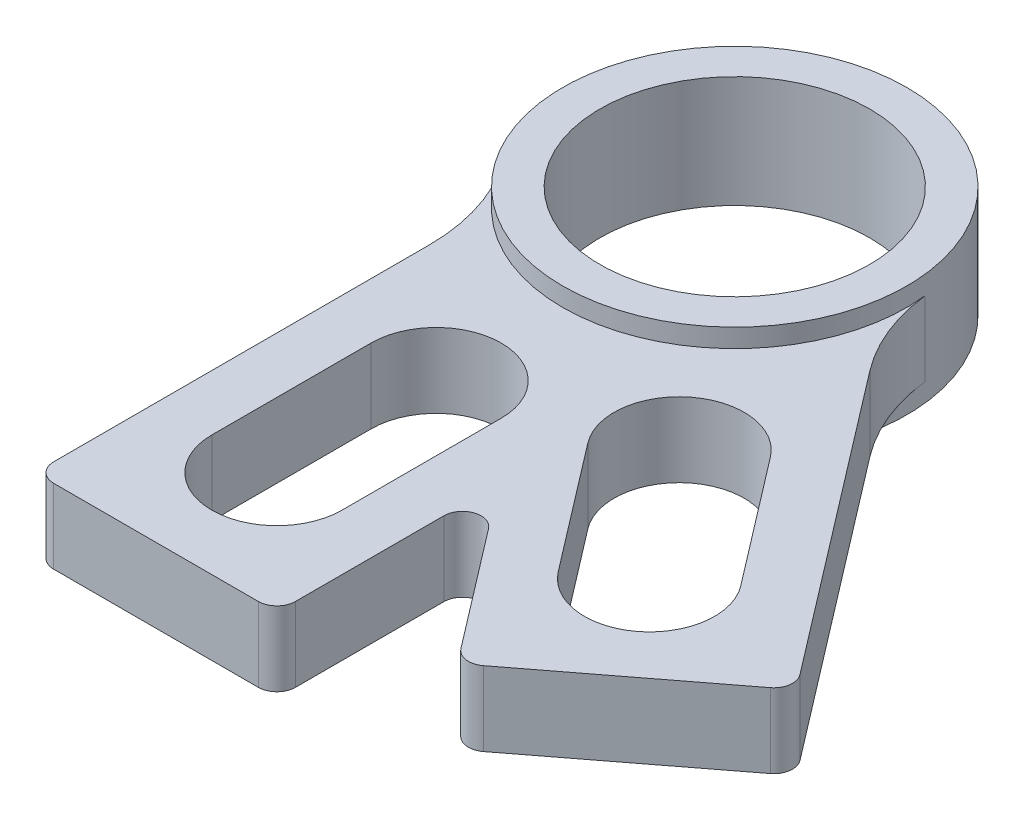
from build123d import *

# Parameters (mm, degrees)
SKETCH1_R                      = 14.6812
SKETCH1_R_2                    = 11.5062
BEARING_INSERT_EXTRUDE_DEPTH   = 4.7625
APEX_SLOT_INSERT_EXTRUDE_DEPTH = 3.175
FILLET1_R                      = 16.002
FILLET2_R                      = 1.5875


with BuildPart() as part:
    # Sketch1 → Bearing_Insert_Extrude (new, symmetric)
    with BuildSketch(Plane(origin=(0, 0, 0), x_dir=(1, 0, 0), z_dir=(0, 1, 0))):
        with Locations(Location((0, 0, 0), (0, 0, 90))):
            Circle(SKETCH1_R)
        with Locations(Location((0, 0, 0), (0, 0, 90))):
            Circle(SKETCH1_R_2, mode=Mode.SUBTRACT)
    extrude(amount=BEARING_INSERT_EXTRUDE_DEPTH, both=True)

    # Sketch1<4> → Apex_Slot_Insert_Extrude (add, symmetric)
    with BuildSketch(Plane(origin=(0, 0, 0), x_dir=(1, 0, 0), z_dir=(0, 1, 0))):
        with BuildLine():
            Line((-10.31875, -10.443228997), (-10.31875, -49.3903))
            Line((-10.31875, -49.3903), (10.31875, -49.3903))
            Line((10.31875, -49.3903), (10.31875, -30.456674331))
            Line((10.31875, -30.456674331), (21.827200563, -45.491226091))
            Line((21.827200563, -45.491226091), (38.2147413, -32.947107355))
            Line((38.2147413, -32.947107355), (14.541491968, -2.020555561))
            ThreePointArc((14.541491968, -2.020555561), (4.710970641, -13.904833298), (-10.31875, -10.443228997))
        make_face()
        with BuildLine():
            ThreePointArc((5.55625, -39.07155), (0, -44.6278), (-5.55625, -39.07155))
            Line((-5.55625, -39.07155), (-5.55625, -25.48255))
            ThreePointArc((-5.55625, -25.48255), (0, -19.9263), (5.55625, -25.48255))
            Line((5.55625, -25.48255), (5.55625, -39.07155))
        make_face(mode=Mode.SUBTRACT)
        with BuildLine():
            ThreePointArc((28.160941762, -27.648133618), (27.1261743, -35.437426553), (19.336881365, -34.402659091))
            Line((19.336881365, -34.402659091), (11.077061644, -23.612093806))
            ThreePointArc((11.077061644, -23.612093806), (12.111829106, -15.822800871), (19.90112204, -16.857568333))
            Line((19.90112204, -16.857568333), (28.160941762, -27.648133618))
        make_face(mode=Mode.SUBTRACT)
    extrude(amount=APEX_SLOT_INSERT_EXTRUDE_DEPTH, both=True)

    # Fillet1
    fillet1_edges = [part.edges().sort_by_distance(p)[0] for p in [
        (14.541491968, 0, 2.020555561),
        (-10.31875, 0, 10.443228997),
    ]]
    fillet(fillet1_edges, radius=FILLET1_R)

    # Fillet2
    fillet2_edges = [part.edges().sort_by_distance(p)[0] for p in [
        (-10.31875, 0, 49.3903),
        (10.31875, 0, 49.3903),
        (10.31875, 0, 30.456674331),
        (21.827200563, 0, 45.491226091),
        (38.2147413, 0, 32.947107355),
    ]]
    fillet(fillet2_edges, radius=FILLET2_R)


solid = part.part
